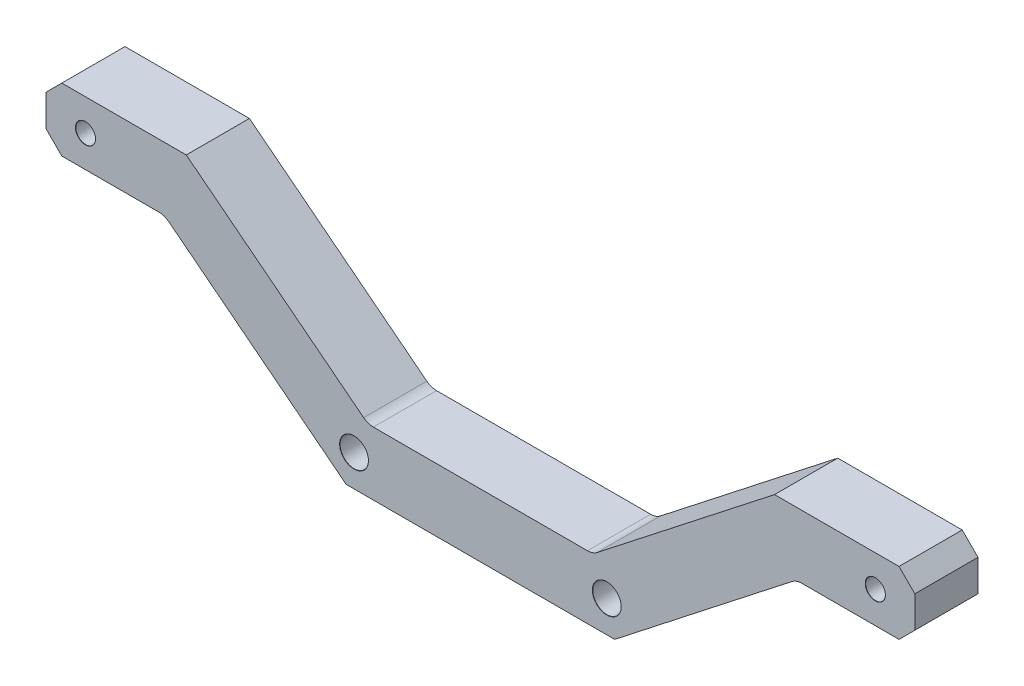
from build123d import *

# Parameters (mm, degrees)
SKETCH1_R                             = 1
BOSS_EXTRUDE1_DEPTH                   = 8
TAP_DRILL_FOR_M3X0_5_TAP1_D           = 2.5
TAP_DRILL_FOR_M3X0_5_TAP1_CSINK_D     = 2.55
TAP_DRILL_FOR_M3X0_5_TAP1_CSINK_ANGLE = 90
M3_CLEARANCE_HOLE1_D                  = 3.6
M3_CLEARANCE_HOLE1_CSINK_D            = 3.65
M3_CLEARANCE_HOLE1_CSINK_ANGLE        = 90
CHAMFER3_SIZE                         = 2
FILLET1_R                             = 2


with BuildPart() as part:
    # Sketch1 → Boss-Extrude1 (new body)
    with BuildSketch(Plane.XY):
        Polygon((-14.241705008, 4), (14.241705008, 4), (37.241705008, 22), (55, 22), (55, 14), (40, 14), (17, -4), (-17, -4), (-40, 14), (-55, 14), (-55, 22), (-37.241705008, 22), align=None)
        with Locations((16, 0)):
            Circle(SKETCH1_R, mode=Mode.SUBTRACT)
        with Locations((50, 18)):
            Circle(SKETCH1_R, mode=Mode.SUBTRACT)
        with Locations(Location((-50, 18, 0), (0, 0, 180))):
            Circle(SKETCH1_R, mode=Mode.SUBTRACT)
        with Locations(Location((-16, 0, 0), (0, 0, 180))):
            Circle(SKETCH1_R, mode=Mode.SUBTRACT)
    extrude(amount=BOSS_EXTRUDE1_DEPTH)

    # Tap Drill for M3x0.5 Tap1 (through all)
    with Locations(Plane.XY.offset(8)):
        with Locations((50, 18), (-50, 18)):
            CounterSinkHole(TAP_DRILL_FOR_M3X0_5_TAP1_D / 2, TAP_DRILL_FOR_M3X0_5_TAP1_CSINK_D / 2, counter_sink_angle=TAP_DRILL_FOR_M3X0_5_TAP1_CSINK_ANGLE)

    # M3 Clearance Hole1 (through all)
    with Locations(Plane.XY.offset(8)):
        with Locations((-16, 0), (16, 0)):
            CounterSinkHole(M3_CLEARANCE_HOLE1_D / 2, M3_CLEARANCE_HOLE1_CSINK_D / 2, counter_sink_angle=M3_CLEARANCE_HOLE1_CSINK_ANGLE)

    # Chamfer3
    chamfer3_edges = [part.edges().sort_by_distance(p)[0] for p in [
        (55, 22, 4),
        (55, 14, 4),
        (-55, 14, 4),
        (-55, 22, 4),
    ]]
    chamfer(chamfer3_edges, length=CHAMFER3_SIZE)

    # Fillet1
    fillet1_edges = [part.edges().sort_by_distance(p)[0] for p in [
        (40, 14, 4),
        (-40, 14, 4),
        (-14.241705008, 4, 4),
        (14.241705008, 4, 4),
    ]]
    fillet(fillet1_edges, radius=FILLET1_R)


solid = part.part
